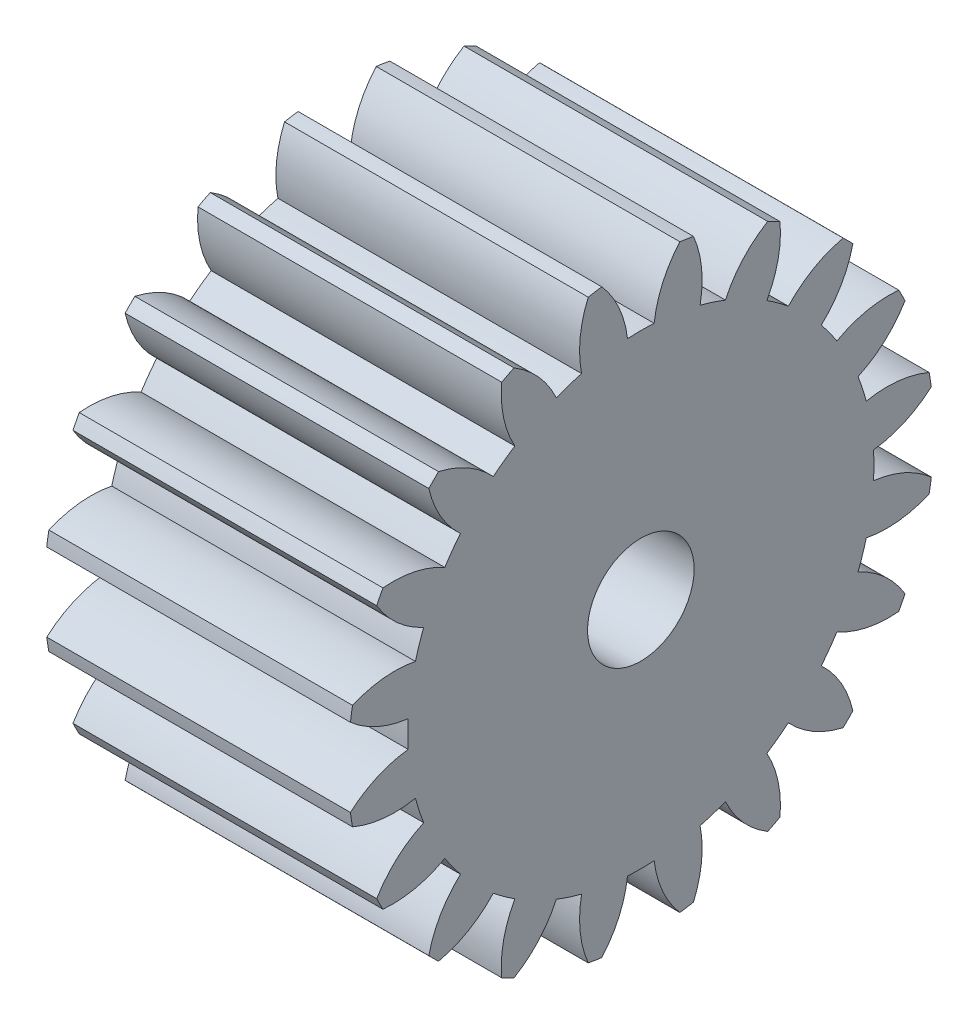
from build123d import *

# Parameters (mm, degrees)
BASPROSKE_W         = 5.7
BASPROSKE_H         = 5.5
TOOTHCUT_DEPTH      = 10.643132271
TEETHCUTS_COUNT     = 20
TEETHCUTS_ANGLE     = 342
BORSKE_R            = 0.4
BORE_DEPTH          = 50.0000508
SKETCH_1_R          = 1
CUT_EXTRUDE_1_DEPTH = 10


with BuildPart() as part:
    # BasProSke → Base-Revolve (revolve)
    with BuildSketch(Plane(origin=(0, 0, 0), x_dir=(1, 0, 0), z_dir=(0, 1, 0)), mode=Mode.PRIVATE) as base_revolve_sk:
        with Locations((2.85, 2.75)):
            Rectangle(BASPROSKE_W, BASPROSKE_H)
    revolve(base_revolve_sk.sketch.rotate(Axis((-10, 0, 0), (1, 0, 0)), 180), axis=Axis((-10, 0, 0), (1, 0, 0)))

    # TooCutSke → ToothCut (cut, through all)
    with BuildSketch(Plane(origin=(0, 0, 0), x_dir=(0, 0, -1), z_dir=(1, 0, 0))):
        with BuildLine():
            ThreePointArc((0.249903181, 4.366855207), (0, 4.374), (-0.249903181, 4.366855207))
            ThreePointArc((-0.249903181, 4.366855207), (-0.415207844, 4.95951031), (-0.752843848, 5.473871692))
            ThreePointArc((-0.752843848, 5.473871692), (0, 5.5254), (0.752843848, 5.473871692))
            ThreePointArc((0.752843848, 5.473871692), (0.415207844, 4.95951031), (0.249903181, 4.366855207))
        make_face()
    toothcut = extrude(amount=TOOTHCUT_DEPTH, mode=Mode.SUBTRACT)

    # TeethCuts: ToothCut ×20 about axis
    teethcuts_axis = Axis((-10, 0, 0), (1, 0, 0))
    for i in range(1, TEETHCUTS_COUNT):
        add(toothcut.rotate(teethcuts_axis, i * TEETHCUTS_ANGLE / (TEETHCUTS_COUNT - 1)), mode=Mode.SUBTRACT)

    # BorSke → Bore (cut, symmetric)
    with BuildSketch(Plane(origin=(0, 0, 0), x_dir=(0, 0, -1), z_dir=(1, 0, 0))):
        with Locations(Location((0, 0, 0), (0, 0, 180))):
            Circle(BORSKE_R)
    extrude(amount=BORE_DEPTH, both=True, mode=Mode.SUBTRACT)

    # 草图1 → 切除-拉伸1 (cut)
    with BuildSketch(Plane(origin=(5.7, 0, 0), x_dir=(0, 0, -1), z_dir=(1, 0, 0))):
        Circle(SKETCH_1_R)
    extrude(amount=-CUT_EXTRUDE_1_DEPTH, mode=Mode.SUBTRACT)


solid = part.part
